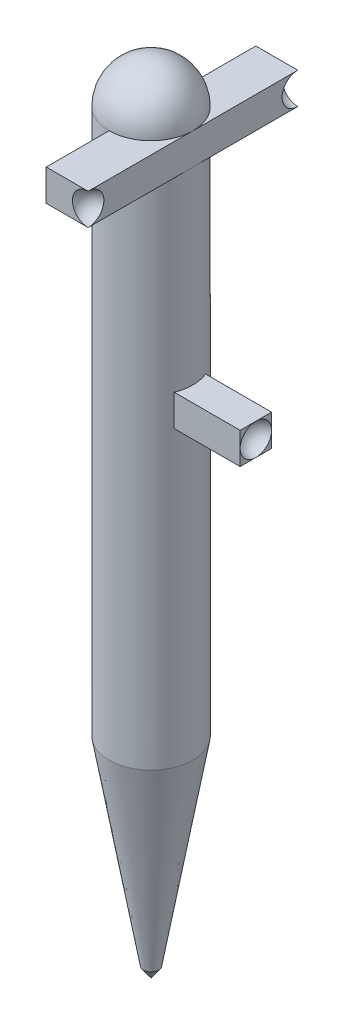
from build123d import *

# Parameters (mm, degrees)
SKETCH4_W           = 50.8
SKETCH4_H           = 38.1
BOSS_EXTRUDE3_DEPTH = 127
SKETCH2_W           = 127
SKETCH2_H           = 38.1
BOSS_EXTRUDE2_DEPTH = 19.05


with BuildPart() as part:
    # Sketch1 → Revolve1 (revolve)
    with BuildSketch(Plane.XY):
        with BuildLine():
            Line((50.8, 0), (50.8, -660.4))
            Line((50.8, -660.4), (9.120840186, -901.7))
            Line((9.120840186, -901.7), (0, -914.4))
            Line((0, -914.4), (0, 50.8))
            ThreePointArc((0, 50.8), (35.921024484, 35.921024484), (50.8, 0))
        make_face()
    revolve(axis=Axis((0, -914.4, 0), (0, 1, 0)))

    # Sketch4 → Boss-Extrude3 (add, symmetric)
    with BuildSketch(Plane.XY):
        with Locations((25.4, -19.05)):
            Rectangle(SKETCH4_W, SKETCH4_H)
    extrude(amount=BOSS_EXTRUDE3_DEPTH, both=True)

    # Sketch2 → Boss-Extrude2 (add, symmetric)
    with BuildSketch(Plane.XY):
        with Locations((63.5, -285.75)):
            Rectangle(SKETCH2_W, SKETCH2_H)
    extrude(amount=BOSS_EXTRUDE2_DEPTH, both=True)

    # Sketch5 → Cut-Revolve1 (revolve, cut)
    with BuildSketch(Plane.XY.offset(127)):
        with BuildLine():
            Line((50.8, 0), (50.8, -38.1))
            ThreePointArc((50.8, -38.1), (31.75, -19.05), (50.8, 0))
        make_face()
    cut_revolve1 = revolve(axis=Axis((50.8, 0, 127), (0, -1, 0)), mode=Mode.SUBTRACT)

    # Mirror1: Cut-Revolve1 across plane
    add(cut_revolve1.mirror(Plane.XY), mode=Mode.SUBTRACT)

    # Sketch6 → Cut-Revolve2 (revolve, cut)
    with BuildSketch(Plane.XY):
        with BuildLine():
            Line((127, -266.7), (127, -304.8))
            ThreePointArc((127, -304.8), (107.95, -285.75), (127, -266.7))
        make_face()
    revolve(axis=Axis((127, -266.7, 0), (0, -1, 0)), mode=Mode.SUBTRACT)


solid = part.part
